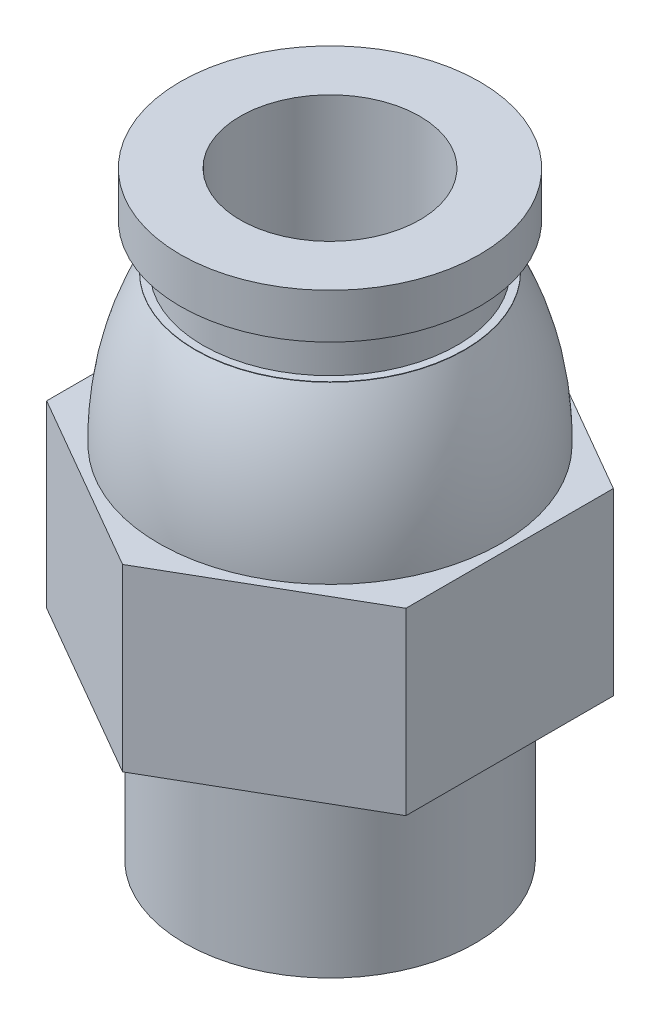
from build123d import *

# Parameters (mm, degrees)
SKETCH_1_R            = 4.85
EXTRUDE_1_DEPTH       = 6
EXTRUDE_2_DEPTH       = 6
SKETCH_3_R            = 4.5
EXTRUDE_3_DEPTH       = 5
SKETCH_4_R            = 4.25
EXTRUDE_4_DEPTH       = 1
SKETCH_5_R            = 3.75
EXTRUDE_5_DEPTH       = 0.5
SKETCH_6_R            = 5
EXTRUDE_6_DEPTH       = 1.5
F_6_0MM_1_D           = 6
F_6_0MM_1_CSINK_D     = 6.05
F_6_0MM_1_CSINK_ANGLE = 90


with BuildPart() as part:
    # 草图1 → 凸台-拉伸1 (new body)
    with BuildSketch(Plane(origin=(0, 0, 0), x_dir=(1, 0, 0), z_dir=(0, 1, 0))):
        with Locations(Location((0, 0, 0), (0, 0, 270))):
            Circle(SKETCH_1_R)
    extrude(amount=EXTRUDE_1_DEPTH)

    # 草图2 → 凸台-拉伸2 (add)
    with BuildSketch(Plane(origin=(0, 6, 0), x_dir=(1, 0, 0), z_dir=(0, 1, 0))):
        Polygon((6, 3.464101615), (0, 6.92820323), (-6, 3.464101615), (-6, -3.464101615), (0, -6.92820323), (6, -3.464101615), align=None)
    extrude(amount=EXTRUDE_2_DEPTH)

    # 草图3 → 凸台-拉伸3 (add)
    with BuildSketch(Plane(origin=(0, 12, 0), x_dir=(1, 0, 0), z_dir=(0, 1, 0))):
        with Locations(Location((0, 0, 0), (0, 0, 270))):
            Circle(SKETCH_3_R)
    extrude(amount=EXTRUDE_3_DEPTH)

    # 草图4 → 凸台-拉伸4 (add)
    with BuildSketch(Plane(origin=(0, 17, 0), x_dir=(1, 0, 0), z_dir=(0, 1, 0))):
        with Locations(Location((0, 0, 0), (0, 0, 270))):
            Circle(SKETCH_4_R)
    extrude(amount=EXTRUDE_4_DEPTH)

    # 草图5 → 凸台-拉伸5 (add)
    with BuildSketch(Plane(origin=(0, 18, 0), x_dir=(1, 0, 0), z_dir=(0, 1, 0))):
        with Locations(Location((0, 0, 0), (0, 0, 270))):
            Circle(SKETCH_5_R)
    extrude(amount=EXTRUDE_5_DEPTH)

    # 草图6 → 凸台-拉伸6 (add)
    with BuildSketch(Plane(origin=(0, 18.5, 0), x_dir=(1, 0, 0), z_dir=(0, 1, 0))):
        with Locations(Location((0, 0, 0), (0, 0, 270))):
            Circle(SKETCH_6_R)
    extrude(amount=EXTRUDE_6_DEPTH)

    # 草图7 → 旋转1 (revolve)
    with BuildSketch(Plane.XY, mode=Mode.PRIVATE) as revolve_1_sk:
        with BuildLine():
            Line((-5.71614298, 12), (-4.5, 12))
            Line((-4.5, 12), (-4.5, 16.986349243))
            add(Edge.make_bspline(
                [(-4.5, 16.986349243), (-5.756767144, 14.677598977), (-5.71614298, 12)],
                knots=[0, 0, 0, 1, 1, 1], degree=2))
        make_face()
    revolve(revolve_1_sk.sketch.rotate(Axis((0, 12, 0), (0, 1, 0)), 180), axis=Axis((0, 12, 0), (0, 1, 0)))

    # Ø6.0mm 暗销孔1 (through all)
    with Locations(Plane(origin=(0, 0, 0), x_dir=(-1, 0, 0), z_dir=(0, -1, 0))):
        with Locations((0, 0)):
            CounterSinkHole(F_6_0MM_1_D / 2, F_6_0MM_1_CSINK_D / 2, counter_sink_angle=F_6_0MM_1_CSINK_ANGLE)


solid = part.part
